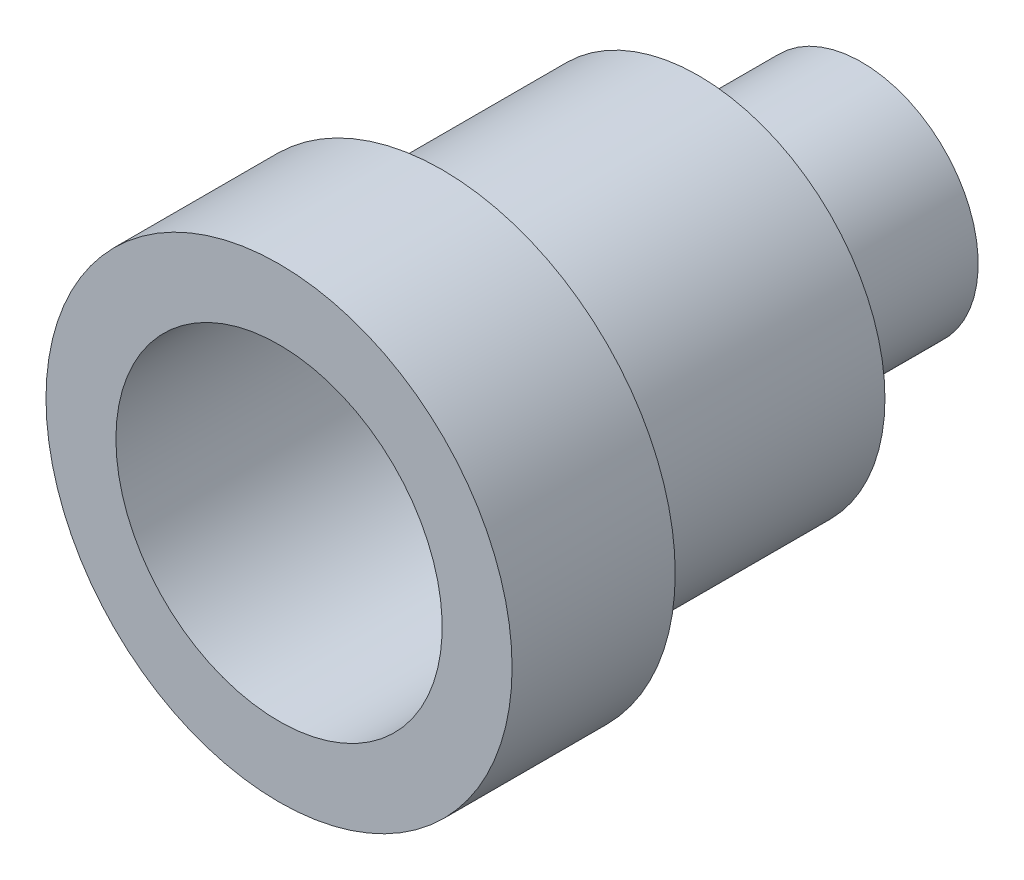
from build123d import *

# Parameters (mm, degrees)
CUT_EXTRUDE2_DEPTH = 2.5


with BuildPart() as part:
    # Sketch1 → Revolve1 (revolve)
    with BuildSketch(Plane(origin=(0, 0, 0), x_dir=(1, 0, 0), z_dir=(0, 1, 0)), mode=Mode.PRIVATE) as revolve1_sk:
        with BuildLine():
            Line((-2818.542001076, 1216.198145417), (-2818.542001076, 1223.198145417))
            Line((-2818.542001076, 1223.198145417), (-2821.042001076, 1223.198145417))
            Line((-2821.042001076, 1223.198145417), (-2821.042001076, 1214.285550771))
            Line((-2821.042001076, 1214.285550771), (-2820.196168753, 1214.285550771))
            Line((-2820.196168753, 1214.285550771), (-2820.196168753, 1211.285550771))
            Line((-2820.196168753, 1211.285550771), (-2818.542001076, 1211.285550771))
            Line((-2818.542001076, 1211.285550771), (-2816.542001076, 1211.285550771))
            Line((-2816.542001076, 1211.285550771), (-2816.542001076, 1198.198145417))
            Line((-2816.542001076, 1198.198145417), (-2813.542001076, 1198.198145417))
            Line((-2813.542001076, 1198.198145417), (-2813.542001076, 1205.198145417))
            Line((-2813.542001076, 1205.198145417), (-2814.542001076, 1205.198145417))
            ThreePointArc((-2814.542001076, 1205.198145417), (-2815.249107857, 1205.491038636), (-2815.542001076, 1206.198145417))
            Line((-2815.542001076, 1206.198145417), (-2815.542001076, 1216.198145417))
            Line((-2815.542001076, 1216.198145417), (-2818.542001076, 1216.198145417))
        make_face()
    revolve(revolve1_sk.sketch.rotate(Axis((-2823.542001076, 0, -1216.198145417), (0, 0, 1)), 180), axis=Axis((-2823.542001076, 0, -1216.198145417), (0, 0, 1)))

    # Sketch2 → Cut-Extrude2 (cut)
    with BuildSketch(Plane.XY.offset(-1211.285550771)):
        Polygon((-2819.327722789, 0), (-2821.434861933, 3.649672055), (-2825.649140219, 3.649672055), (-2827.756279362, 0), (-2825.649140219, -3.649672055), (-2821.434861933, -3.649672055), align=None)
    extrude(amount=-CUT_EXTRUDE2_DEPTH, mode=Mode.SUBTRACT)


solid = part.part
